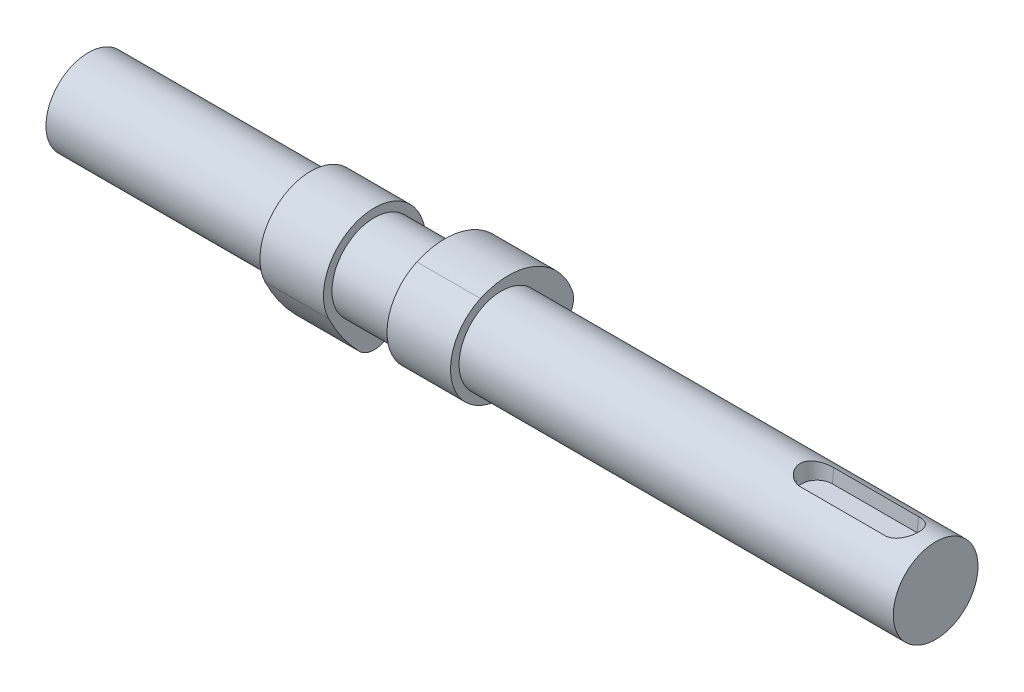
from build123d import *

# Parameters (mm, degrees)
BOSS_EXTRUDE1_DEPTH      = 125
BOSS_EXTRUDE1_DEPTH_BACK = 75
SKETCH1_R                = 10
BOSS_EXTRUDE2_START      = 15
BOSS_EXTRUDE2_DEPTH      = 7.5
BODY_MOVE_COPY4_ANGLE    = 90
CUT_EXTRUDE1_START       = 10
CUT_EXTRUDE1_DEPTH       = 4
CUT_EXTRUDE1_DRAFT       = -5


with BuildPart() as part:
    # Sketch1 → Boss-Extrude1 (new, two sides: drawn at the far end of the back side and taken through both)
    with BuildSketch(Plane(origin=(0, 0, 0), x_dir=(0, 0, -1), z_dir=(1, 0, 0)).offset(-BOSS_EXTRUDE1_DEPTH_BACK)):
        Circle(SKETCH1_R)
    extrude(amount=BOSS_EXTRUDE1_DEPTH + BOSS_EXTRUDE1_DEPTH_BACK)

    # Sketch2 → Boss-Extrude2 (add, symmetric)
    with BuildSketch(Plane(origin=(0, 0, 0), x_dir=(0, 0, -1), z_dir=(1, 0, 0)).offset(BOSS_EXTRUDE2_START)):
        with BuildLine():
            ThreePointArc((-4.950818385, 10.931120589), (-10.855235073, -5.115063196), (5.27814522, -10.776881879))
            ThreePointArc((5.27814522, -10.776881879), (10.675009162, -7.586625818), (15.507108825, -3.59229396))
            ThreePointArc((15.507108825, -3.59229396), (16.895326586, -1.149524968), (16.746983201, 1.656230392))
            ThreePointArc((16.746983201, 1.656230392), (7.939134659, 11.068540296), (-4.950818385, 10.931120589))
        make_face()
    boss_extrude2 = extrude(amount=BOSS_EXTRUDE2_DEPTH, both=True)

    # Mirror3: Boss-Extrude2 across plane
    add(boss_extrude2.mirror(Plane(origin=(0, 0, 0), x_dir=(0, 0, 1), z_dir=(1, 0, 0))))


with BuildPart() as body_2:
    # Split1: the piece on the far side of the plane
    add(part.part)
    split(bisect_by=Plane(origin=(0, 0, 0), x_dir=(0, 0, 1), z_dir=(1, 0, 0)), keep=Keep.BOTTOM)


with BuildPart() as part_1:
    add(part.part)

    # Split1
    split(bisect_by=Plane(origin=(0, 0, 0), x_dir=(0, 0, 1), z_dir=(1, 0, 0)), keep=Keep.TOP)


with BuildPart() as body_2_1:
    # Body-Move/Copy4: moved
    add(body_2.part.rotate(Axis((0, 0, 0), (-1, 0, 0)), BODY_MOVE_COPY4_ANGLE))

    # Combine1: union part
    add(part_1.part)


with BuildPart() as cut_extrude1_tool:
    # Sketch5 → Cut-Extrude1 (with draft: the straight prism first)
    with BuildSketch(Plane(origin=(0, 0, 0), x_dir=(1, 0, 0), z_dir=(0, 1, 0)).offset(CUT_EXTRUDE1_START)):
        with BuildLine():
            ThreePointArc((97, 4), (93, 0), (97, -4))
            Line((97, -4), (117, -4))
            ThreePointArc((117, -4), (121, 0), (117, 4))
            Line((117, 4), (97, 4))
        make_face()
    extrude(amount=-CUT_EXTRUDE1_DEPTH)
    # Cut-Extrude1: the draft: its side faces are tilted about the plane it starts from
    cut_extrude1_sides = [cut_extrude1_tool.faces().sort_by_distance(p)[0] for p in [
        (121, 8, 0),
        (107, 8, -4),
        (93, 8, 0),
        (107, 8, 4),
    ]]
    draft(cut_extrude1_sides, Plane(origin=(0, 0, 0), x_dir=(1, 0, 0), z_dir=(0, 1, 0)).offset(CUT_EXTRUDE1_START), CUT_EXTRUDE1_DRAFT)


with BuildPart() as body_2_2:
    add(body_2_1.part)

    # Cut-Extrude1: cut by cut_extrude1_tool
    add(cut_extrude1_tool.part, mode=Mode.SUBTRACT)


solid = body_2_2.part
